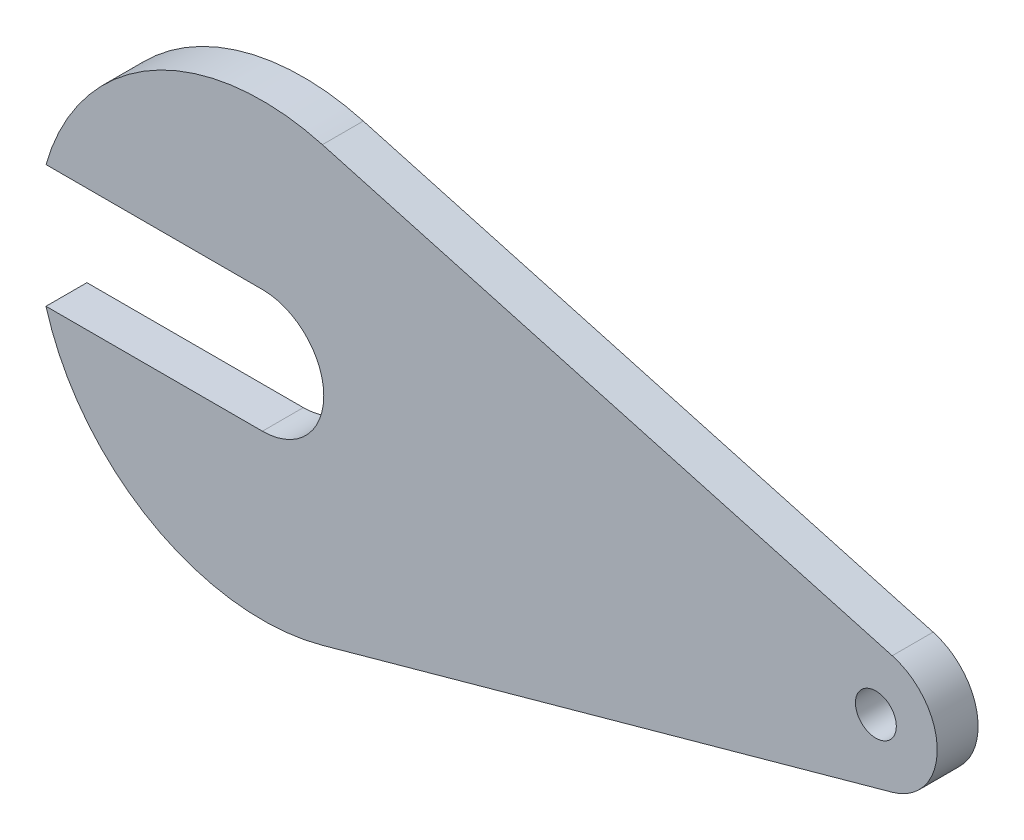
from build123d import *

# Parameters (mm, degrees)
MODEL_R                 = 1.5
SALIENTE_EXTRUIR1_DEPTH = 3


with BuildPart() as part:
    # Model → Saliente-Extruir1 (new body)
    with BuildSketch(Plane.XY):
        with BuildLine():
            Line((220.147807914, 226.049504469), (261.947807914, 237.614970305))
            ThreePointArc((261.947807914, 237.614970305), (265.247807914, 241.952019993), (261.947807914, 246.289069682))
            Line((261.947807914, 246.289069682), (220.147807914, 257.854535517))
            ThreePointArc((220.147807914, 257.854535517), (207.659518678, 256.333590743), (199.873300047, 246.452019993))
            Line((199.873300047, 246.452019993), (215.747807914, 246.452019993))
            ThreePointArc((215.747807914, 246.452019993), (220.247807913, 241.952019993), (215.747807914, 237.452019993))
            Line((215.747807914, 237.452019993), (199.873300047, 237.452019993))
            ThreePointArc((199.873300047, 237.452019993), (207.659518678, 227.570449243), (220.147807914, 226.049504469))
        make_face()
        with Locations((260.747807914, 241.952019993)):
            Circle(MODEL_R, mode=Mode.SUBTRACT)
    extrude(amount=SALIENTE_EXTRUIR1_DEPTH)


solid = part.part
